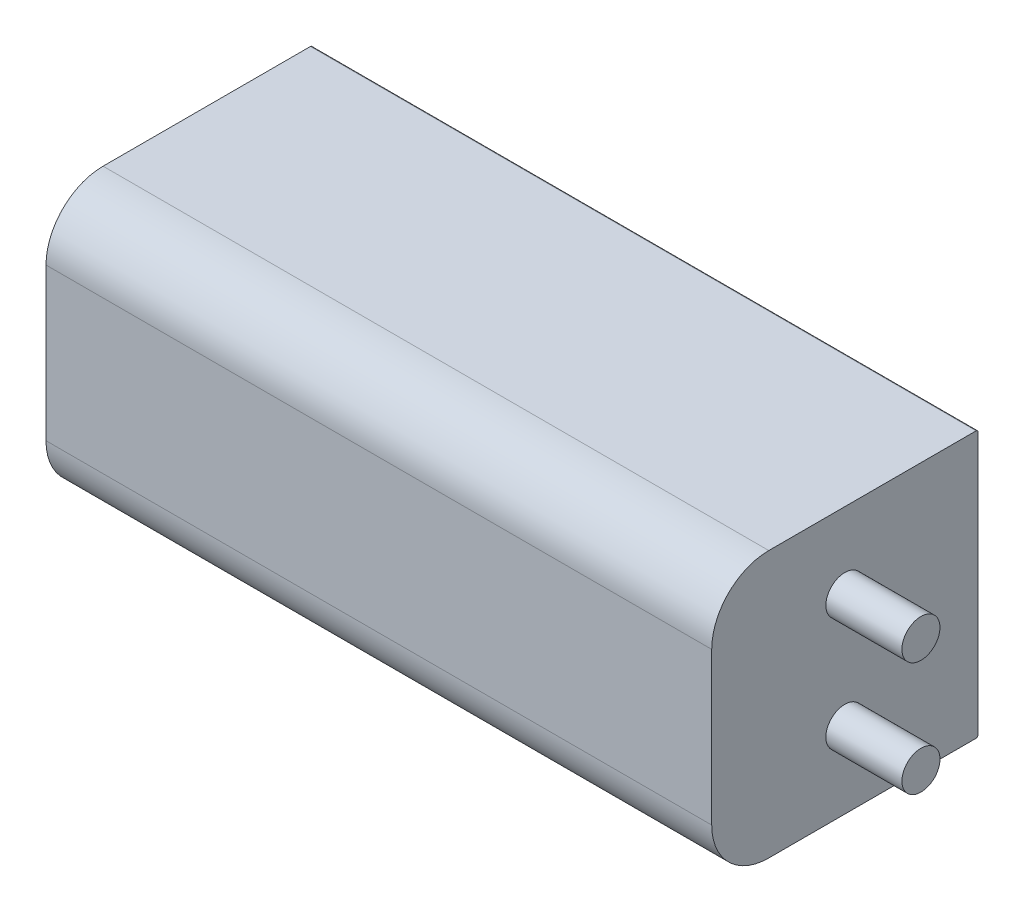
from build123d import *

# Parameters (mm, degrees)
SKETCH1_W           = 350
SKETCH1_H           = 140
BOSS_EXTRUDE1_DEPTH = 140
SKETCH2_R           = 10.5
CUT_EXTRUDE3_DEPTH  = 41
FILLET2_R           = 30
FILLET3_R           = 1
SKETCH3_R           = 10
BOSS_EXTRUDE3_DEPTH = 40


with BuildPart() as part:
    # Sketch1 → Boss-Extrude1 (new body)
    with BuildSketch(Plane(origin=(0, 0, 0), x_dir=(1, 0, 0), z_dir=(0, 1, 0))):
        with Locations((175, -70)):
            Rectangle(SKETCH1_W, SKETCH1_H)
    extrude(amount=BOSS_EXTRUDE1_DEPTH)

    # Sketch2 → Cut-Extrude3 (cut)
    with BuildSketch(Plane(origin=(0, 0, 0), x_dir=(0, 0, -1), z_dir=(1, 0, 0))):
        with Locations((-70, 100)):
            Circle(SKETCH2_R)
        with Locations((-70, 40)):
            Circle(SKETCH2_R)
    extrude(amount=CUT_EXTRUDE3_DEPTH, mode=Mode.SUBTRACT)

    # Fillet2
    fillet2_edges = [part.edges().sort_by_distance(p)[0] for p in [
        (175, 140, 140),
        (175, 0, 140),
    ]]
    fillet(fillet2_edges, radius=FILLET2_R)

    # Fillet3
    fillet3_edges = [part.edges().sort_by_distance(p)[0] for p in [
        (175, 140, 0),
        (175, 0, 0),
    ]]
    fillet(fillet3_edges, radius=FILLET3_R)

    # Sketch3 → Boss-Extrude3 (add)
    with BuildSketch(Plane(origin=(350, 0, 0), x_dir=(0, 0, -1), z_dir=(1, 0, 0))):
        with Locations((-70, 100)):
            Circle(SKETCH3_R)
        with Locations((-70, 40)):
            Circle(SKETCH3_R)
    extrude(amount=BOSS_EXTRUDE3_DEPTH)


solid = part.part
